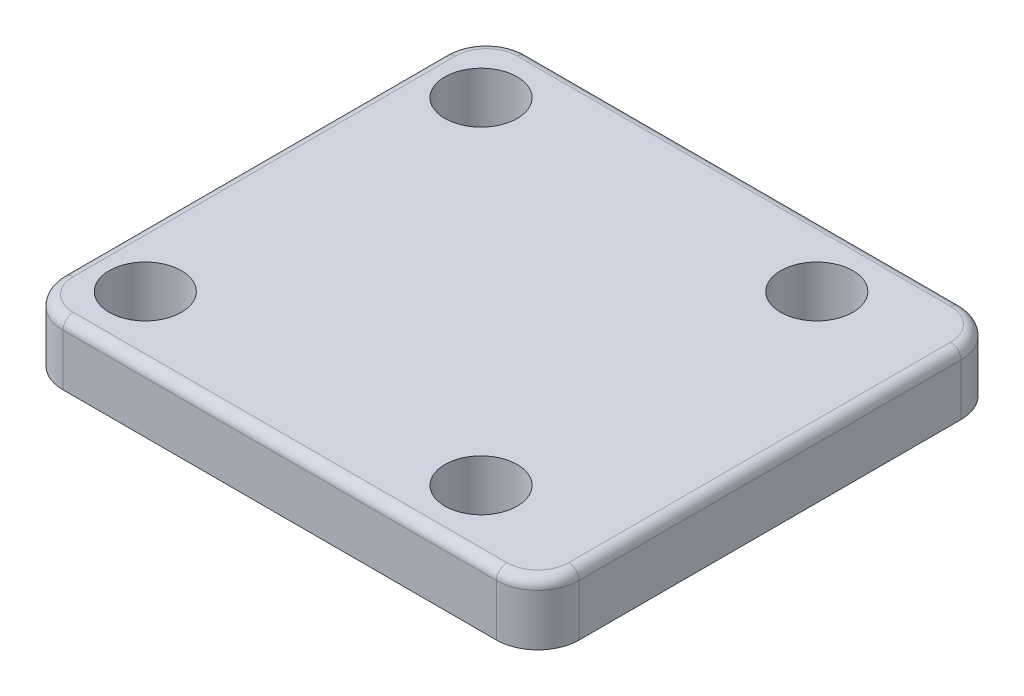
from build123d import *

# Parameters (mm, degrees)
BOSS_EXTRUDE1_DEPTH = 6
FILLET1_R           = 1
SKETCH2_R           = 16
BOSS_EXTRUDE2_DEPTH = 2
CHAMFER1_SIZE       = 1
CHAMFER1_SIZE2      = 1.732050808
SKETCH3_R           = 3.5
CUT_EXTRUDE1_DEPTH  = 37.800135869


with BuildPart() as part:
    # Sketch1 → Boss-Extrude1 (new body)
    with BuildSketch(Plane(origin=(0, 0, 0), x_dir=(1, 0, 0), z_dir=(0, 1, 0))):
        with BuildLine():
            Line((24, 22.5), (-18, 22.5))
            ThreePointArc((-18, 22.5), (-20.828427125, 21.328427125), (-22, 18.5))
            Line((-22, 18.5), (-22, -18.5))
            ThreePointArc((-22, -18.5), (-20.828427125, -21.328427125), (-18, -22.5))
            Line((-18, -22.5), (24, -22.5))
            ThreePointArc((24, -22.5), (26.828427125, -21.328427125), (28, -18.5))
            Line((28, -18.5), (28, 18.5))
            ThreePointArc((28, 18.5), (26.828427125, 21.328427125), (24, 22.5))
        make_face()
    extrude(amount=BOSS_EXTRUDE1_DEPTH)

    # Fillet1
    fillet1_edges = [part.edges().sort_by_distance(p)[0] for p in [
        (-20.828427125, 6, 21.328427125),
        (3, 6, 22.5),
        (26.828427125, 6, 21.328427125),
        (28, 6, 0),
        (26.828427125, 6, -21.328427125),
        (3, 6, -22.5),
        (-20.828427125, 6, -21.328427125),
        (-22, 6, 0),
    ]]
    fillet(fillet1_edges, radius=FILLET1_R)

    # Sketch2 → Boss-Extrude2 (add)
    with BuildSketch(Plane.XZ):
        with Locations(Location((0, 0, 0), (0, 0, 270))):
            Circle(SKETCH2_R)
    extrude(amount=BOSS_EXTRUDE2_DEPTH)

    # Chamfer1
    chamfer1_edges = [part.edges().sort_by_distance(p)[0] for p in [
        (0, -2, 16),
    ]]
    chamfer1_side = [part.faces().sort_by_distance(p)[0] for p in [
        (0, -1, 16),
    ]]
    chamfer(chamfer1_edges, length=CHAMFER1_SIZE, length2=CHAMFER1_SIZE2, reference=chamfer1_side[0])

    # Sketch3 → Cut-Extrude1 (cut, through all)
    with BuildSketch(Plane(origin=(0, 6, 0), x_dir=(1, 0, 0), z_dir=(0, 1, 0))):
        with Locations(Location((-16.263455967, 16.263455967, 0), (0, 0, 270))):
            Circle(SKETCH3_R)
        with Locations(Location((16.263455967, 16.263455967, 0), (0, 0, 270))):
            Circle(SKETCH3_R)
        with Locations(Location((16.263455967, -16.263455967, 0), (0, 0, 270))):
            Circle(SKETCH3_R)
        with Locations(Location((-16.263455967, -16.263455967, 0), (0, 0, 270))):
            Circle(SKETCH3_R)
    extrude(amount=-CUT_EXTRUDE1_DEPTH, mode=Mode.SUBTRACT)


solid = part.part
